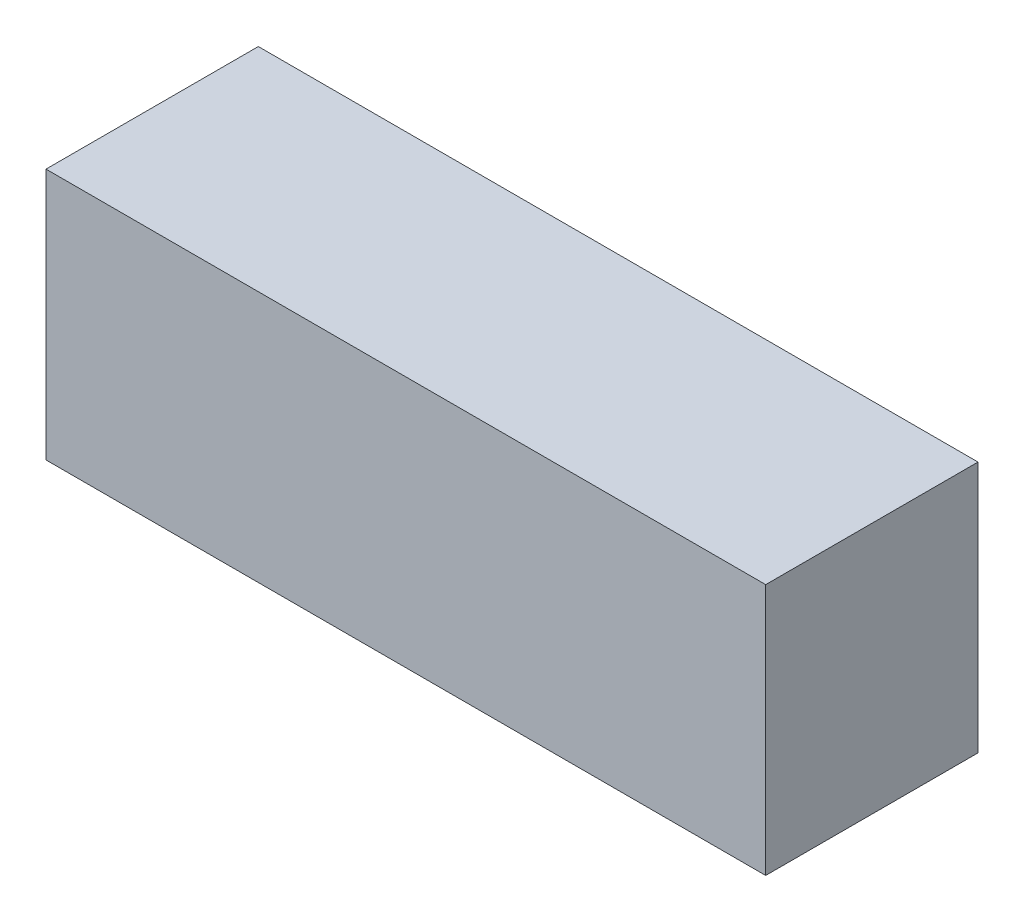
from build123d import *

# Parameters (mm, degrees)
SKETCH1_W           = 200
SKETCH1_H           = 70
BOSS_EXTRUDE1_DEPTH = 59
SKETCH5_W           = 35
SKETCH5_H           = 24.63
CUT_EXTRUDE3_DEPTH  = 20


with BuildPart() as part:
    # Sketch1 → Boss-Extrude1 (new body)
    with BuildSketch(Plane.XY):
        with Locations((39.363861945, 35)):
            Rectangle(SKETCH1_W, SKETCH1_H)
    extrude(amount=BOSS_EXTRUDE1_DEPTH)

    # Sketch5 → Cut-Extrude3 (cut)
    with BuildSketch(Plane(origin=(0, 0, 0), x_dir=(-1, 0, 0), z_dir=(0, -1, 0))):
        with Locations((38.136138055, -29.5)):
            Rectangle(SKETCH5_W, SKETCH5_H)
        with Locations((-116.863861945, -29.5)):
            Rectangle(SKETCH5_W, SKETCH5_H)
    extrude(amount=-CUT_EXTRUDE3_DEPTH, mode=Mode.SUBTRACT)


solid = part.part
